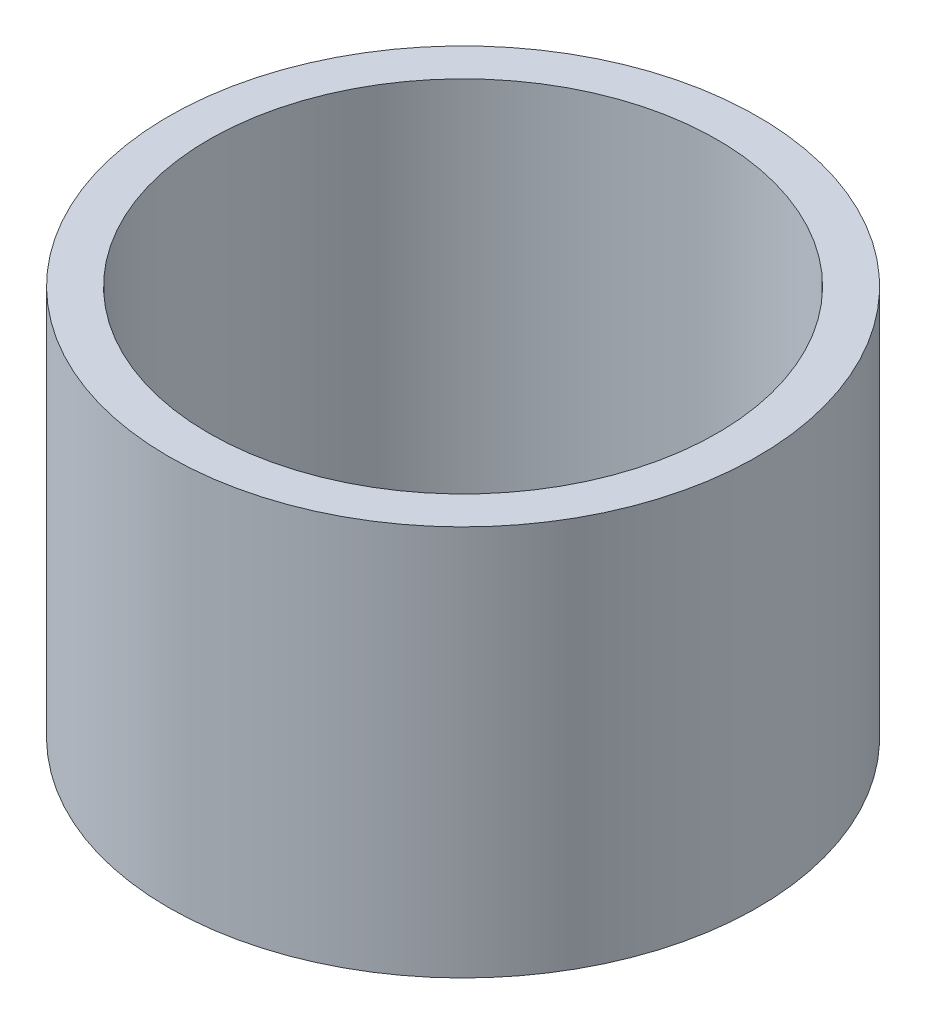
from build123d import *

# Parameters (mm, degrees)
SKETCH1_R           = 4.75
SKETCH1_R_2         = 4.1
BOSS_EXTRUDE1_DEPTH = 6.3


with BuildPart() as part:
    # Sketch1 → Boss-Extrude1 (new body)
    with BuildSketch(Plane(origin=(0, 0, 0), x_dir=(1, 0, 0), z_dir=(0, 1, 0))):
        with Locations(Location((0, 0, 0), (0, 0, 270))):
            Circle(SKETCH1_R)
        with Locations(Location((0, 0, 0), (0, 0, 270))):
            Circle(SKETCH1_R_2, mode=Mode.SUBTRACT)
    extrude(amount=BOSS_EXTRUDE1_DEPTH)


solid = part.part
